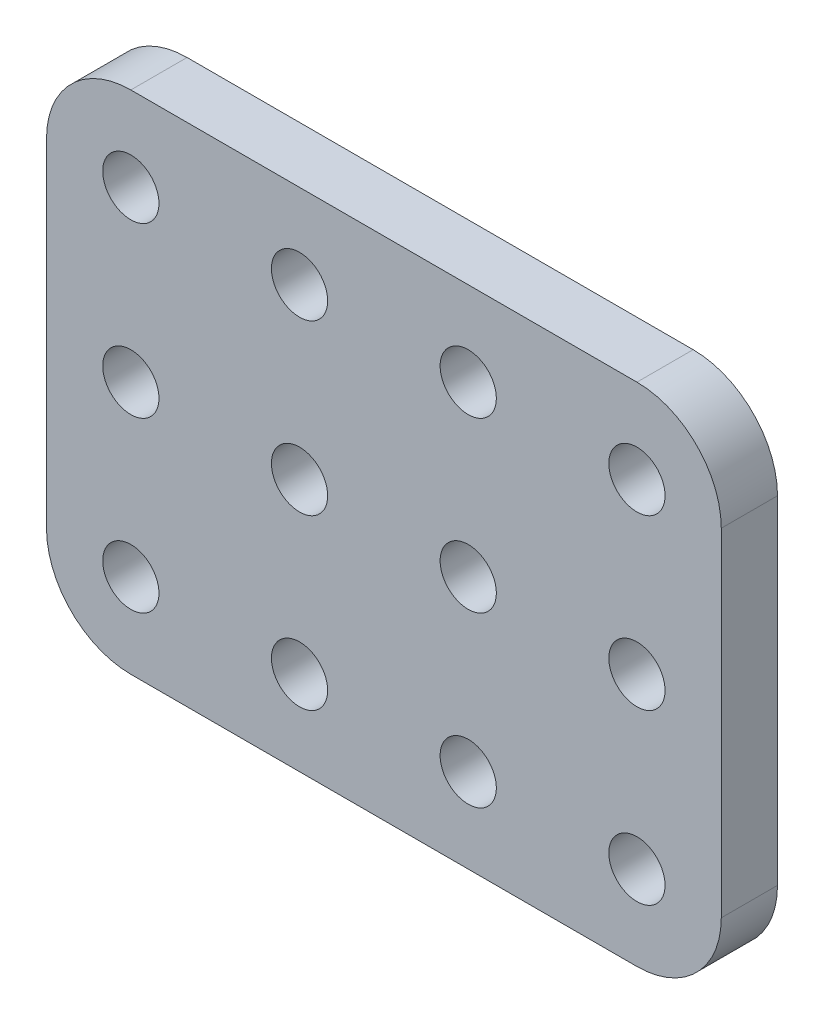
from build123d import *

# Parameters (mm, degrees)
MODEL_R                 = 1.5
SALIENTE_EXTRUIR1_DEPTH = 3


with BuildPart() as part:
    # Model → Saliente-Extruir1 (new body)
    with BuildSketch(Plane.XY):
        with BuildLine():
            Line((-105.943383637, 92.056539338), (-105.943383637, 74.056539338))
            ThreePointArc((-105.943383637, 74.056539338), (-104.625364152, 70.874558823), (-101.443383637, 69.556539338))
            Line((-101.443383637, 69.556539338), (-74.443383637, 69.556539338))
            ThreePointArc((-74.443383637, 69.556539338), (-71.261403122, 70.874558823), (-69.943383637, 74.056539338))
            Line((-69.943383637, 74.056539338), (-69.943383637, 92.056539338))
            ThreePointArc((-69.943383637, 92.056539338), (-71.261403122, 95.238519853), (-74.443383637, 96.556539338))
            Line((-74.443383637, 96.556539338), (-101.443383637, 96.556539338))
            ThreePointArc((-101.443383637, 96.556539338), (-104.625364152, 95.238519853), (-105.943383637, 92.056539338))
        make_face()
        with Locations((-101.443383637, 92.056539338)):
            Circle(MODEL_R, mode=Mode.SUBTRACT)
        with Locations((-92.443383637, 92.056539338)):
            Circle(MODEL_R, mode=Mode.SUBTRACT)
        with Locations((-83.443383637, 92.056539338)):
            Circle(MODEL_R, mode=Mode.SUBTRACT)
        with Locations((-74.443383637, 92.056539338)):
            Circle(MODEL_R, mode=Mode.SUBTRACT)
        with Locations((-101.443383637, 83.056539338)):
            Circle(MODEL_R, mode=Mode.SUBTRACT)
        with Locations((-92.443383637, 83.056539338)):
            Circle(MODEL_R, mode=Mode.SUBTRACT)
        with Locations((-83.443383637, 83.056539338)):
            Circle(MODEL_R, mode=Mode.SUBTRACT)
        with Locations((-74.443383637, 83.056539338)):
            Circle(MODEL_R, mode=Mode.SUBTRACT)
        with Locations((-101.443383637, 74.056539338)):
            Circle(MODEL_R, mode=Mode.SUBTRACT)
        with Locations((-92.443383637, 74.056539338)):
            Circle(MODEL_R, mode=Mode.SUBTRACT)
        with Locations((-83.443383637, 74.056539338)):
            Circle(MODEL_R, mode=Mode.SUBTRACT)
        with Locations((-74.443383637, 74.056539338)):
            Circle(MODEL_R, mode=Mode.SUBTRACT)
    extrude(amount=SALIENTE_EXTRUIR1_DEPTH)


solid = part.part
